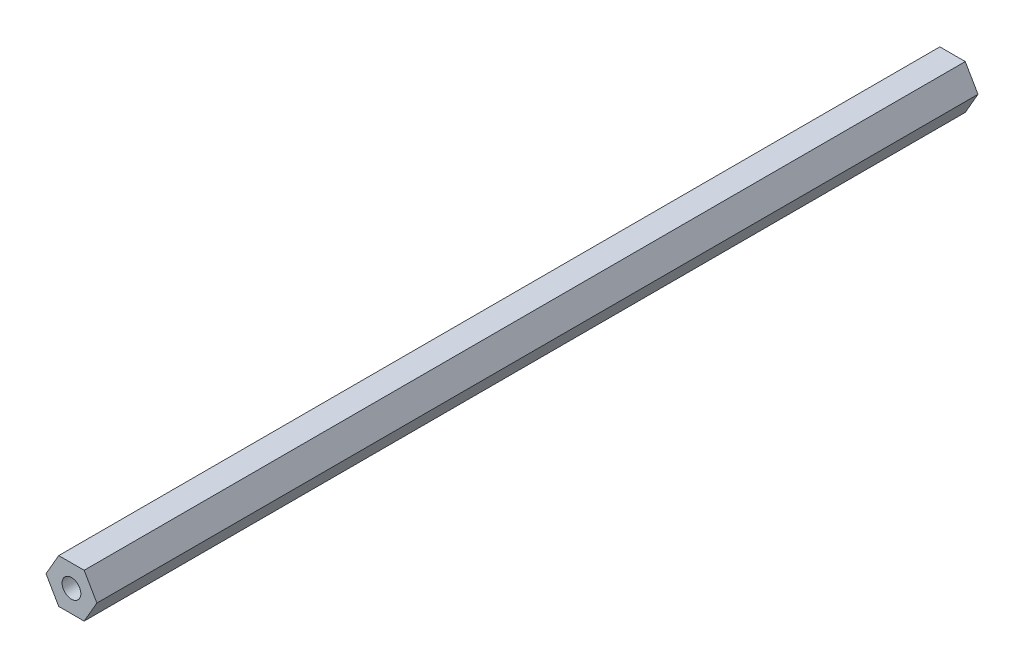
from build123d import *

# Parameters (mm, degrees)
BOSS_EXTRUDE1_DEPTH                   = 127
F_1_4_28_TAPPED_HOLE1_D               = 5.4102
F_1_4_28_TAPPED_HOLE1_DEPTH           = 28.194
F_1_4_28_TAPPED_HOLE1_TIP             = 1.625388061
F_1_4_28_TAPPED_HOLE1_ON_FACE_2_D     = 5.4102
F_1_4_28_TAPPED_HOLE1_ON_FACE_2_DEPTH = 28.194
F_1_4_28_TAPPED_HOLE1_ON_FACE_2_TIP   = 1.625388061


with BuildPart() as part:
    # Sketch1 → Boss-Extrude1 (new, symmetric)
    with BuildSketch(Plane.XY):
        Polygon((7.332348419, 0), (3.666174209, 6.35), (-3.666174209, 6.35), (-7.332348419, 0), (-3.666174209, -6.35), (3.666174209, -6.35), align=None)
    extrude(amount=BOSS_EXTRUDE1_DEPTH, both=True)

    # 1/4-28 Tapped Hole1
    with Locations(Plane.XY.offset(127)):
        with Locations((0, 0)):
            Hole(F_1_4_28_TAPPED_HOLE1_D / 2, depth=F_1_4_28_TAPPED_HOLE1_DEPTH)
            with Locations((0, 0, -(F_1_4_28_TAPPED_HOLE1_DEPTH + F_1_4_28_TAPPED_HOLE1_TIP / 2))):  # 118° drill point
                Cone(0, F_1_4_28_TAPPED_HOLE1_D / 2, F_1_4_28_TAPPED_HOLE1_TIP, mode=Mode.SUBTRACT)

    # 1/4-28 Tapped Hole1 on face 2
    with Locations(Plane(origin=(0, 0, -127), x_dir=(-1, 0, 0), z_dir=(0, 0, -1))):
        with Locations((0, 0)):
            Hole(F_1_4_28_TAPPED_HOLE1_ON_FACE_2_D / 2, depth=F_1_4_28_TAPPED_HOLE1_ON_FACE_2_DEPTH)
            with Locations((0, 0, -(F_1_4_28_TAPPED_HOLE1_ON_FACE_2_DEPTH + F_1_4_28_TAPPED_HOLE1_ON_FACE_2_TIP / 2))):  # 118° drill point
                Cone(0, F_1_4_28_TAPPED_HOLE1_ON_FACE_2_D / 2, F_1_4_28_TAPPED_HOLE1_ON_FACE_2_TIP, mode=Mode.SUBTRACT)


solid = part.part
